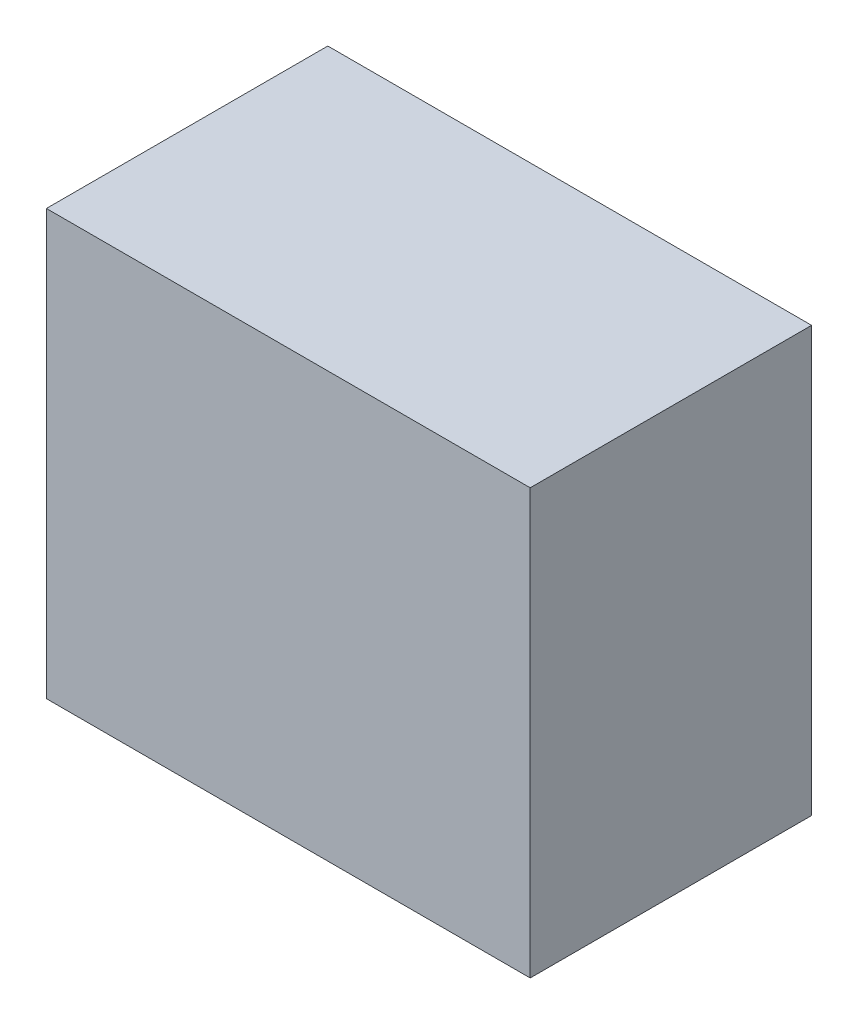
from build123d import *

# Parameters (mm, degrees)
SKETCH1_W           = 98
SKETCH1_H           = 57
BOSS_EXTRUDE1_DEPTH = 43


with BuildPart() as part:
    # Sketch1 → Boss-Extrude1 (new, symmetric)
    with BuildSketch(Plane(origin=(0, 0, 0), x_dir=(1, 0, 0), z_dir=(0, 1, 0))):
        Rectangle(SKETCH1_W, SKETCH1_H)
    extrude(amount=BOSS_EXTRUDE1_DEPTH, both=True)


solid = part.part
